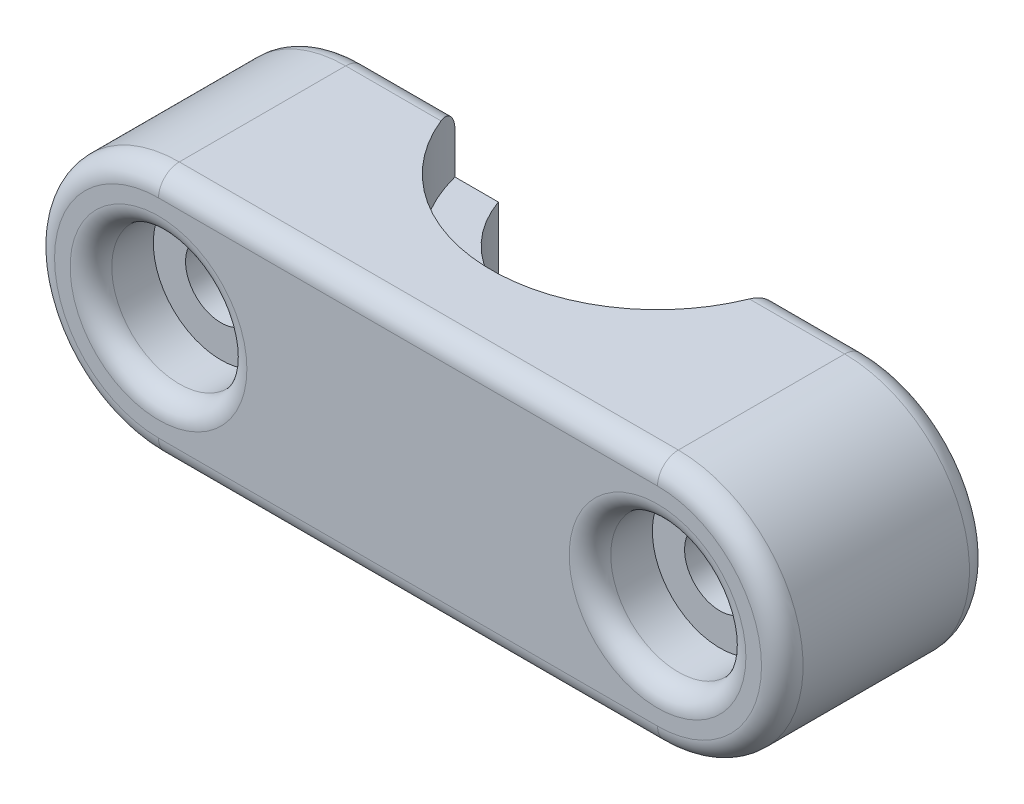
from build123d import *

# Parameters (mm, degrees)
BOSS_EXTRUDE1_START            = 2
BOSS_EXTRUDE1_DEPTH            = 10
CBORE_FOR_M3_SHCS2_D           = 3.4
CBORE_FOR_M3_SHCS2_CBORE_D     = 6.5
CBORE_FOR_M3_SHCS2_CBORE_DEPTH = 3
FILLET1_R                      = 1


with BuildPart() as part:
    # Sketch1 → Boss-Extrude1 (new body)
    with BuildSketch(Plane.XY.offset(BOSS_EXTRUDE1_START)):
        with BuildLine():
            Line((-12, 6), (12, 6))
            ThreePointArc((12, 6), (18, 0), (12, -6))
            Line((12, -6), (-12, -6))
            ThreePointArc((-12, -6), (-18, 0), (-12, 6))
        make_face()
    extrude(amount=BOSS_EXTRUDE1_DEPTH)

    # CBORE for M3 SHCS2 (through all)
    with Locations(Plane.XY.offset(12)):
        with Locations((-12, 0), (12, 0)):
            CounterBoreHole(CBORE_FOR_M3_SHCS2_D / 2, CBORE_FOR_M3_SHCS2_CBORE_D / 2, CBORE_FOR_M3_SHCS2_CBORE_DEPTH)

    # Fillet1
    fillet1_edges = [part.edges().sort_by_distance(p)[0] for p in [
        (18, 0, 12),
        (0, 6, 12),
        (8.75, 0, 12),
        (-15.25, 0, 12),
        (-18, 0, 12),
        (0, 6, 2),
        (18, 0, 2),
        (0, -6, 2),
        (-18, 0, 2),
        (0, -6, 12),
    ]]
    fillet(fillet1_edges, radius=FILLET1_R)

    # Sketch13 → Cut-Revolve1 (revolve, cut)
    with BuildSketch(Plane(origin=(0, 0, 0), x_dir=(0, 0, -1), z_dir=(1, 0, 0))):
        Polygon((0, 6), (0, -6), (8, -6), (8, -3), (6, -3), (6, 3), (8, 3), (8, 6), align=None)
    revolve(axis=Axis((0, 6, 0), (0, -1, 0)), mode=Mode.SUBTRACT)


solid = part.part
